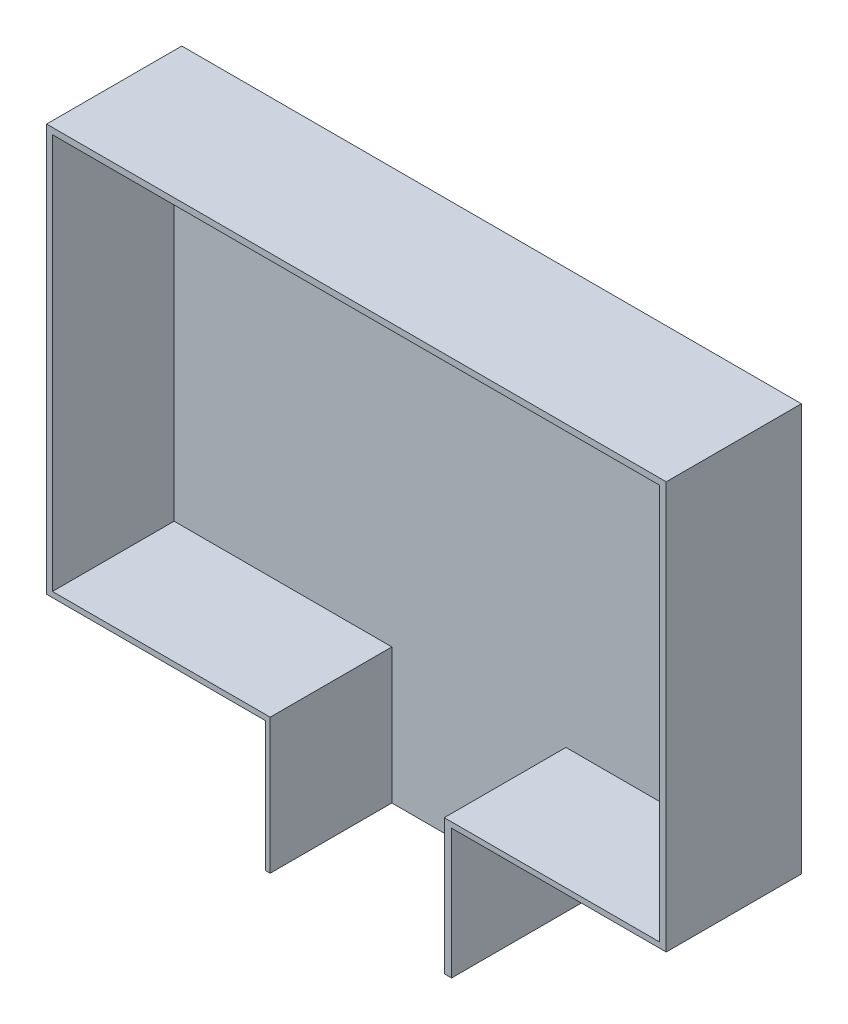
from build123d import *

# Parameters (mm, degrees)
SKETCH1_W           = 45.833760325
SKETCH1_H           = 30.125125166
SKETCH1_W_2         = 13.763297708
SKETCH1_H_2         = 9.6
BOSS_EXTRUDE1_DEPTH = 10
SKETCH2_W           = 44.896748031
SKETCH2_H           = 29.260196601
SKETCH2_W_2         = 12.87697359
SKETCH2_H_2         = 10
CUT_EXTRUDE1_DEPTH  = 9


with BuildPart() as part:
    # Sketch1 → Boss-Extrude1 (new body)
    with BuildSketch(Plane.XY):
        with Locations((164.06406709, 6.50813998)):
            Rectangle(SKETCH1_W, SKETCH1_H)
        with Locations((164.223693767, -13.354422603)):
            Rectangle(SKETCH1_W_2, SKETCH1_H_2)
    extrude(amount=BOSS_EXTRUDE1_DEPTH)

    # Sketch2 → Cut-Extrude1 (cut)
    with BuildSketch(Plane.XY.offset(10)):
        with Locations((164.028585862, 6.475675697)):
            Rectangle(SKETCH2_W, SKETCH2_H)
        with Locations((164.12441469, -13.154422603)):
            Rectangle(SKETCH2_W_2, SKETCH2_H_2)
    extrude(amount=-CUT_EXTRUDE1_DEPTH, mode=Mode.SUBTRACT)


solid = part.part
